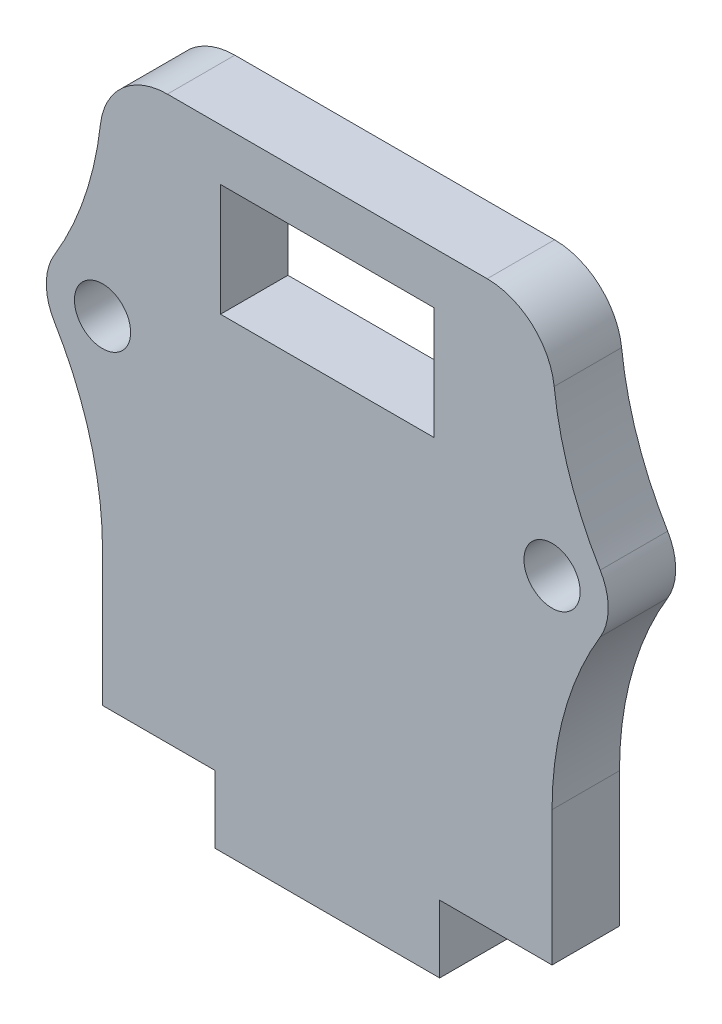
from build123d import *

# Parameters (mm, degrees)
CROQUIS1_W              = 25
CROQUIS1_H              = 28
CROQUIS1_R              = 1.25
CROQUIS1_W_2            = 9.5
CROQUIS1_H_2            = 5
SALIENTE_EXTRUIR1_DEPTH = 1.5
CROQUIS2_W              = 2.5
CROQUIS2_H              = 3
CROQUIS2_W_2            = 5
CORTAR_EXTRUIR1_DEPTH   = 10
REDONDEO1_R             = 15
REDONDEO2_R             = 3


with BuildPart() as part:
    # Croquis1 → Saliente-Extruir1 (new, symmetric)
    with BuildSketch(Plane.XY):
        Rectangle(CROQUIS1_W, CROQUIS1_H)
        with Locations((-10, 4)):
            Circle(CROQUIS1_R, mode=Mode.SUBTRACT)
        with Locations((10, 4)):
            Circle(CROQUIS1_R, mode=Mode.SUBTRACT)
        with Locations((0, 9.2)):
            Rectangle(CROQUIS1_W_2, CROQUIS1_H_2, mode=Mode.SUBTRACT)
    extrude(amount=SALIENTE_EXTRUIR1_DEPTH, both=True)

    # Croquis2 → Cortar-Extruir1 (cut)
    with BuildSketch(Plane.XY.offset(1.5)):
        with Locations((-11.25, -12.5)):
            Rectangle(CROQUIS2_W, CROQUIS2_H)
        with Locations((-7.5, -12.5)):
            Rectangle(CROQUIS2_W_2, CROQUIS2_H)
        with Locations((7.5, -12.5)):
            Rectangle(CROQUIS2_W_2, CROQUIS2_H)
        with Locations((11.25, -12.5)):
            Rectangle(CROQUIS2_W, CROQUIS2_H)
        with BuildLine():
            Line((-12.5, -11), (-10, -11))
            Line((-10, -11), (-10, 1.5))
            ThreePointArc((-10, 1.5), (-11.767766953, 2.232233047), (-12.5, 4))
            Line((-12.5, 4), (-12.5, -11))
        make_face()
        with BuildLine():
            Line((10, 1.5), (10, -11))
            Line((10, -11), (12.5, -11))
            Line((12.5, -11), (12.5, 4))
            ThreePointArc((12.5, 4), (11.767766953, 2.232233047), (10, 1.5))
        make_face()
        with BuildLine():
            Line((12.5, 14), (10, 14))
            Line((10, 14), (10, 6.5))
            ThreePointArc((10, 6.5), (11.767766953, 5.767766953), (12.5, 4))
            Line((12.5, 4), (12.5, 14))
        make_face()
        with BuildLine():
            ThreePointArc((-12.5, 4), (-11.767766953, 5.767766953), (-10, 6.5))
            Line((-10, 6.5), (-10, 14))
            Line((-10, 14), (-12.5, 14))
            Line((-12.5, 14), (-12.5, 4))
        make_face()
    extrude(amount=-CORTAR_EXTRUIR1_DEPTH, mode=Mode.SUBTRACT)

    # Redondeo1
    redondeo1_edges = [part.edges().sort_by_distance(p)[0] for p in [
        (-10, 6.5, 0),
        (-10, 1.5, 0),
        (10, 1.5, 0),
        (10, 6.5, 0),
    ]]
    fillet(redondeo1_edges, radius=REDONDEO1_R)

    # Redondeo2
    redondeo2_edges = [part.edges().sort_by_distance(p)[0] for p in [
        (10, 14, 0),
        (-10, 14, 0),
    ]]
    fillet(redondeo2_edges, radius=REDONDEO2_R)


solid = part.part
